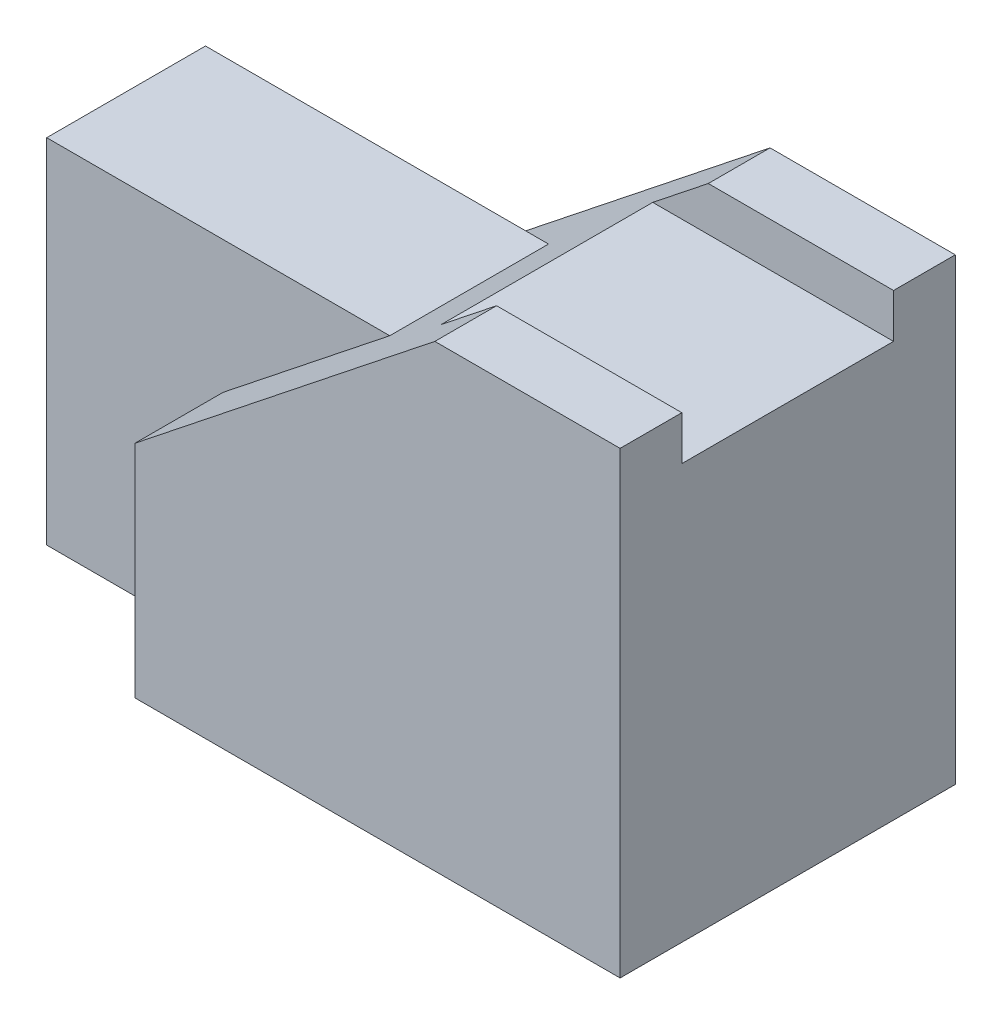
from build123d import *

# Parameters (mm, degrees)
BOSS_EXTRUDE1_DEPTH      = 19
BOSS_EXTRUDE1_DEPTH_BACK = 19
BOSS_EXTRUDE2_DEPTH      = 9
BOSS_EXTRUDE2_DEPTH_BACK = 9
SKETCH2_W                = 24
SKETCH2_H                = 5
CUT_EXTRUDE2_DEPTH       = 76


with BuildPart() as part:
    # Sketch1 → Boss-Extrude1 (new, two sides: drawn at the far end of the back side and taken through both)
    with BuildSketch(Plane.XY.offset(-BOSS_EXTRUDE1_DEPTH_BACK)):
        Polygon((-35.570076419, -4.126221996), (-35.570076419, -29.126221996), (19.429923581, -29.126221996), (19.429923581, 22.873778004), (-1.570076419, 22.873778004), (-16.681187531, 10.873778004), align=None)
    extrude(amount=BOSS_EXTRUDE1_DEPTH + BOSS_EXTRUDE1_DEPTH_BACK)

    # Sketch1<3> → Boss-Extrude2 (add, two sides: drawn at the far end of the back side and taken through both)
    with BuildSketch(Plane.XY.offset(-BOSS_EXTRUDE2_DEPTH_BACK)):
        Polygon((-55.570076419, -29.126221996), (-35.570076419, -29.126221996), (-35.570076419, -4.126221996), (-16.681187531, 10.873778004), (-55.570076419, 10.873778004), align=None)
    extrude(amount=BOSS_EXTRUDE2_DEPTH + BOSS_EXTRUDE2_DEPTH_BACK)

    # Sketch2 → Cut-Extrude2 (cut)
    with BuildSketch(Plane(origin=(19.429923581, 0, 0), x_dir=(0, 0, -1), z_dir=(1, 0, 0))):
        with Locations((0, 20.373778004)):
            Rectangle(SKETCH2_W, SKETCH2_H)
    extrude(amount=-CUT_EXTRUDE2_DEPTH, mode=Mode.SUBTRACT)


solid = part.part
